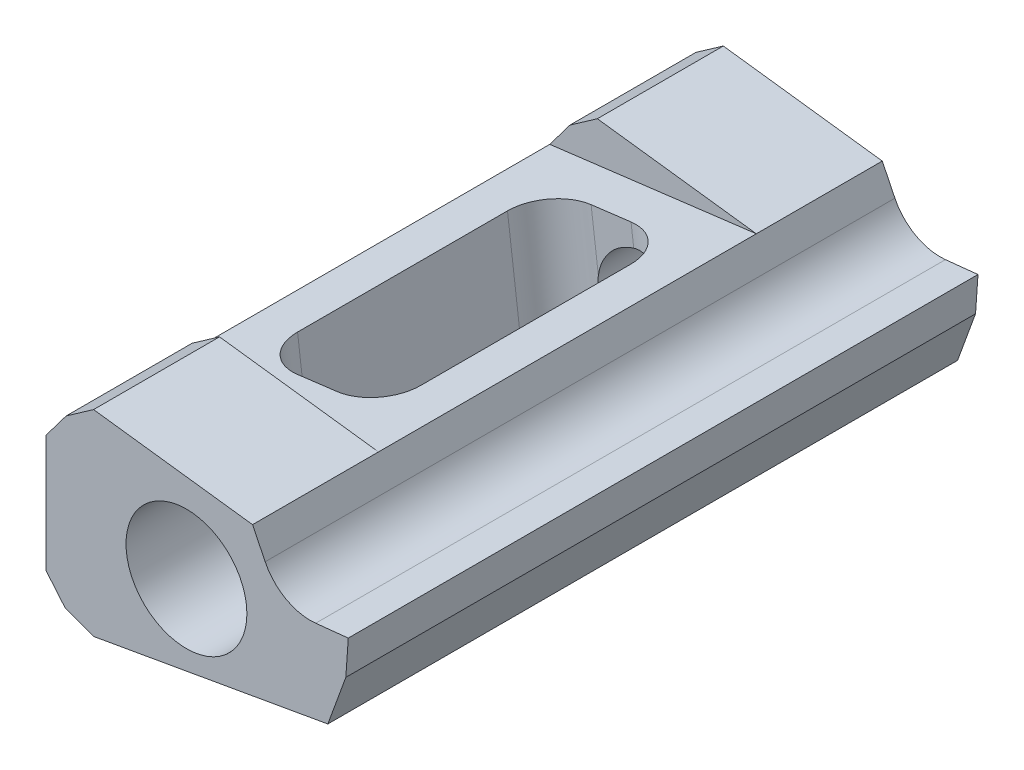
from build123d import *

# Parameters (mm, degrees)
RESSALTO_EXTRUS_O1_DEPTH   = 250
ESCALA1_SCALE              = 1.5
CORTE_EXTRUS_O1_START      = -75
CORTE_EXTRUS_O1_DEPTH      = 225
CORTE_EXTRUS_O3_DEPTH      = 344.667466727
CORTE_EXTRUS_O3_DEPTH_BACK = 344.667466727
ESBO_O7_R                  = 36
CORTE_EXTRUS_O4_DEPTH      = 69
ESBO_O7_3_R                = 30
CORTE_EXTRUS_O5_DEPTH      = 395.013784799
CORTE_EXTRUS_O6_START      = -306
ESBO_O7_4_R                = 36
ESBO_O7_4_R_2              = 30
CORTE_EXTRUS_O6_DEPTH      = 69


with BuildPart() as part:
    # Esboço1 → Ressalto-extrusão1 (new body)
    with BuildSketch(Plane.XY):
        with BuildLine():
            Line((65, 0), (64.021024633, -14))
            Line((64.021024633, -14), (56.886629039, -33.601590794))
            Line((56.886629039, -33.601590794), (-36.113370961, -50))
            Line((-36.113370961, -50), (-47.32844057, -45.918048487))
            Line((-47.32844057, -45.918048487), (-55, -36.775439975))
            Line((-55, -36.775439975), (-55, 9.746573698))
            Line((-55, 9.746573698), (-47, 20.366669268))
            Line((-47, 20.366669268), (-36.113370961, 28))
            Line((-36.113370961, 28), (27, 20))
            Line((27, 20), (32.013345877, 9.746573698))
            ThreePointArc((32.013345877, 9.746573698), (40.293006212, 1.034435734), (52.07121536, -1.358870022))
            Line((52.07121536, -1.358870022), (65, 0))
        make_face()
    extrude(amount=RESSALTO_EXTRUS_O1_DEPTH)


with BuildPart() as part_1:
    # Escala1: scaled about (-3.384050485, -11.684350271, 125)
    add(part.part.scale(ESCALA1_SCALE).moved(Location((1.692025242, 5.842175135, -62.5))))

    # Esboço4 → Corte-extrusão1 (cut)
    with BuildSketch(Plane(origin=(0, 0, -62.5), x_dir=(-1, 0, 0), z_dir=(0, 0, -1)).offset(CORTE_EXTRUS_O1_START)):
        Polygon((69.300635612, -63.034897595), (80.807974757, -49.320984827), (-87.021968802, -44.560211056), (52.478031198, -69.157824864), align=None)
        Polygon((-42.192025243, 35.842175136), (80.807974757, 20.462035682), (68.807974757, 36.392179037), (52.478031198, 47.842175136), align=None)
    extrude(amount=-CORTE_EXTRUS_O1_DEPTH, mode=Mode.SUBTRACT)

    # Esboço6 → Corte-extrusão3 (cut, two sides: drawn at the far end of the back side and taken through both)
    with BuildSketch(Plane(origin=(-3.763238402, 30.095846977, 0), x_dir=(0.9922727729449546, 0.12407555791585548, 0), z_dir=(-0.12407555791585548, 0.9922727729449546, 0)).offset(-CORTE_EXTRUS_O3_DEPTH_BACK)):
        with BuildLine():
            Line((-27.644714695, -37.5), (-3.68686424, -37.5))
            ThreePointArc((-3.68686424, -37.5), (13.99080529, -44.82233047), (21.31313576, -62.5))
            Line((21.31313576, -62.5), (21.31313576, -187.5))
            ThreePointArc((21.31313576, -187.5), (13.99080529, -205.17766953), (-3.68686424, -212.5))
            Line((-3.68686424, -212.5), (-27.644714695, -212.5))
            ThreePointArc((-27.644714695, -212.5), (-45.322384225, -205.17766953), (-52.644714695, -187.5))
            Line((-52.644714695, -187.5), (-52.644714695, -62.5))
            ThreePointArc((-52.644714695, -62.5), (-45.322384225, -44.82233047), (-27.644714695, -37.5))
        make_face()
    extrude(amount=CORTE_EXTRUS_O3_DEPTH + CORTE_EXTRUS_O3_DEPTH_BACK, mode=Mode.SUBTRACT)

    # Esboço7 → Corte-extrusão4 (cut)
    with BuildSketch(Plane.XY.offset(312.5)):
        with Locations((2.82595792, -11.797691618)):
            Circle(ESBO_O7_R)
    extrude(amount=-CORTE_EXTRUS_O4_DEPTH, mode=Mode.SUBTRACT)

    # Esboço7<3> → Corte-extrusão5 (cut, through all)
    with BuildSketch(Plane.XY.offset(312.5)):
        with Locations((2.82595792, -11.797691618)):
            Circle(ESBO_O7_3_R)
    extrude(amount=-CORTE_EXTRUS_O5_DEPTH, mode=Mode.SUBTRACT)

    # Esboço7<4> → Corte-extrusão6 (cut)
    with BuildSketch(Plane.XY.offset(312.5).offset(CORTE_EXTRUS_O6_START)):
        with Locations((2.82595792, -11.797691618)):
            Circle(ESBO_O7_4_R)
        with Locations((2.82595792, -11.797691618)):
            Circle(ESBO_O7_4_R_2, mode=Mode.SUBTRACT)
    extrude(amount=-CORTE_EXTRUS_O6_DEPTH, mode=Mode.SUBTRACT)


solid = part_1.part
